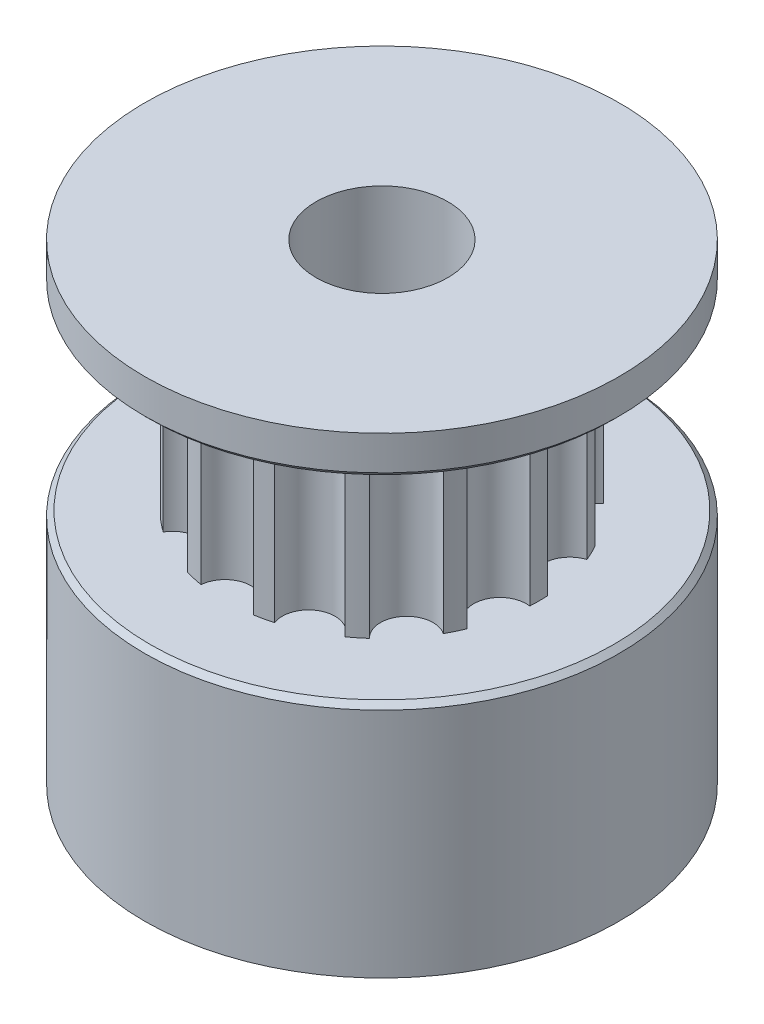
from build123d import *

# Parameters (mm, degrees)
SKETCH_2_R          = 9
EXTRUDE_1_DEPTH     = 9
EXTRUDE_2_DEPTH     = 7.4
SKETCH_4_R          = 9
EXTRUDE_3_DEPTH     = 1.5
SKETCH_5_R          = 2.5
CUT_EXTRUDE_1_DEPTH = 22.963833909
CHAMFER_1_SIZE      = 0.2


with BuildPart() as part:
    # 草图2 → 凸台-拉伸1 (new body)
    with BuildSketch(Plane(origin=(0, 0, 0), x_dir=(1, 0, 0), z_dir=(0, 1, 0))):
        with Locations(Location((0, 0, 0), (0, 0, 270))):
            Circle(SKETCH_2_R)
    extrude(amount=EXTRUDE_1_DEPTH)

    # 草图3 → 凸台-拉伸2 (add)
    with BuildSketch(Plane(origin=(0, 9, 0), x_dir=(1, 0, 0), z_dir=(0, 1, 0))):
        with BuildLine():
            ThreePointArc((-3.444184526, 4.855302323), (-3.711538364, 4.654121901), (-3.967166599, 4.438238037))
            ThreePointArc((-3.967166599, 4.438238037), (-3.872290418, 3.088048563), (-5.20973976, 2.880100577))
            ThreePointArc((-5.20973976, 2.880100577), (-5.363328331, 2.582842797), (-5.499972914, 2.277425222))
            ThreePointArc((-5.499972914, 2.277425222), (-4.828667171, 1.102111772), (-5.943442141, 0.334459589))
            ThreePointArc((-5.943442141, 0.334459589), (-5.952845345, 0), (-5.943442141, -0.334459589))
            ThreePointArc((-5.943442141, -0.334459589), (-4.828667171, -1.102111772), (-5.499972914, -2.277425222))
            ThreePointArc((-5.499972914, -2.277425222), (-5.363328331, -2.582842797), (-5.20973976, -2.880100577))
            ThreePointArc((-5.20973976, -2.880100577), (-3.872290418, -3.088048563), (-3.967166599, -4.438238037))
            ThreePointArc((-3.967166599, -4.438238037), (-3.711538364, -4.654121901), (-3.444184526, -4.855302323))
            ThreePointArc((-3.444184526, -4.855302323), (-2.148959057, -4.462359463), (-1.648614285, -5.720003377))
            ThreePointArc((-1.648614285, -5.720003377), (-1.324632706, -5.803595083), (-0.996466307, -5.868851898))
            ThreePointArc((-0.996466307, -5.868851898), (0, -4.952845345), (0.996466307, -5.868851898))
            ThreePointArc((0.996466307, -5.868851898), (1.324632706, -5.803595083), (1.648614285, -5.720003377))
            ThreePointArc((1.648614285, -5.720003377), (2.148959057, -4.462359463), (3.444184526, -4.855302323))
            ThreePointArc((3.444184526, -4.855302323), (3.711538364, -4.654121901), (3.967166599, -4.438238037))
            ThreePointArc((3.967166599, -4.438238037), (3.872290418, -3.088048563), (5.20973976, -2.880100577))
            ThreePointArc((5.20973976, -2.880100577), (5.363328331, -2.582842797), (5.499972914, -2.277425222))
            ThreePointArc((5.499972914, -2.277425222), (4.828667171, -1.102111772), (5.943442141, -0.334459589))
            ThreePointArc((5.943442141, -0.334459589), (5.952845345, 0), (5.943442141, 0.334459589))
            ThreePointArc((5.943442141, 0.334459589), (4.828667171, 1.102111772), (5.499972914, 2.277425222))
            ThreePointArc((5.499972914, 2.277425222), (5.363328331, 2.582842797), (5.20973976, 2.880100577))
            ThreePointArc((5.20973976, 2.880100577), (3.872290418, 3.088048563), (3.967166599, 4.438238037))
            ThreePointArc((3.967166599, 4.438238037), (3.711538364, 4.654121901), (3.444184526, 4.855302323))
            ThreePointArc((3.444184526, 4.855302323), (2.148959057, 4.462359463), (1.648614285, 5.720003377))
            ThreePointArc((1.648614285, 5.720003377), (1.324632706, 5.803595083), (0.996466307, 5.868851898))
            ThreePointArc((0.996466307, 5.868851898), (0, 4.952845345), (-0.996466307, 5.868851898))
            ThreePointArc((-0.996466307, 5.868851898), (-1.324632706, 5.803595083), (-1.648614285, 5.720003377))
            ThreePointArc((-1.648614285, 5.720003377), (-2.148959057, 4.462359463), (-3.444184526, 4.855302323))
        make_face()
    extrude(amount=EXTRUDE_2_DEPTH)

    # 草图4 → 凸台-拉伸3 (add)
    with BuildSketch(Plane(origin=(0, 16.4, 0), x_dir=(1, 0, 0), z_dir=(0, 1, 0))):
        with Locations(Location((0, 0, 0), (0, 0, 270))):
            Circle(SKETCH_4_R)
    extrude(amount=EXTRUDE_3_DEPTH)

    # 草图5 → 切除-拉伸1 (cut, through all)
    with BuildSketch(Plane(origin=(0, 17.9, 0), x_dir=(1, 0, 0), z_dir=(0, 1, 0))):
        with Locations(Location((0, 0, 0), (0, 0, 270))):
            Circle(SKETCH_5_R)
    extrude(amount=-CUT_EXTRUDE_1_DEPTH, mode=Mode.SUBTRACT)

    # 倒角1
    chamfer_1_edges = [part.edges().sort_by_distance(p)[0] for p in [
        (0, 9, -9),
        (0, 16.4, -9),
    ]]
    chamfer(chamfer_1_edges, length=CHAMFER_1_SIZE)


solid = part.part
